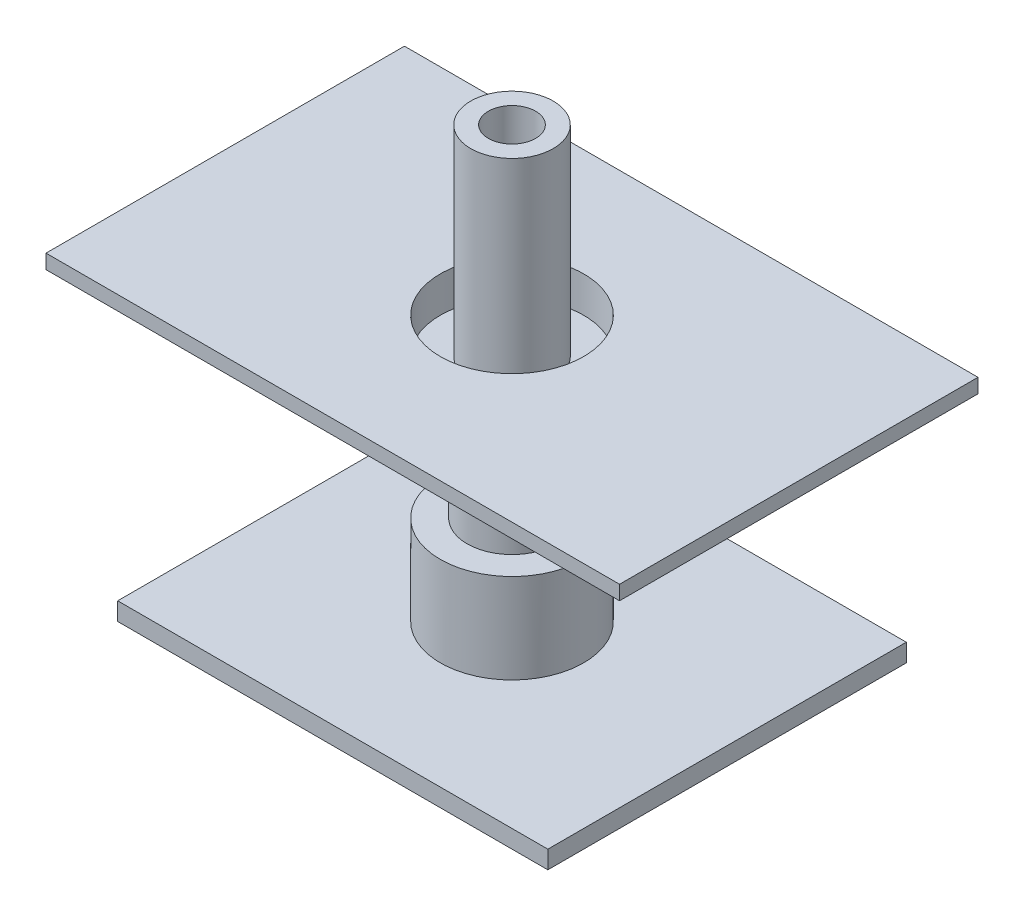
from build123d import *

# Parameters (mm, degrees)
SKETCH1_W           = 120
SKETCH1_H           = 100
BOSS_EXTRUDE1_DEPTH = 5
SKETCH2_R           = 20
SKETCH2_R_2         = 12.5
BOSS_EXTRUDE2_DEPTH = 25
SKETCH4_R           = 12.5
BOSS_EXTRUDE3_DEPTH = 60
SKETCH5_R           = 6.586855475
CUT_EXTRUDE1_DEPTH  = 30
SKETCH9_R           = 11.5
SKETCH9_R_2         = 6.586855475
BOSS_EXTRUDE6_DEPTH = 60
BOSS_EXTRUDE4_START = 10
SKETCH6_W           = 160
SKETCH6_H           = 100
SKETCH6_R           = 12.5
BOSS_EXTRUDE4_DEPTH = 4
SKETCH10_R          = 22.5
SKETCH10_R_2        = 11.5
BOSS_EXTRUDE7_DEPTH = 14
CUT_EXTRUDE5_START  = -10
SKETCH8_R           = 20
SKETCH8_R_2         = 11.5
CUT_EXTRUDE5_DEPTH  = 10


with BuildPart() as part:
    # Sketch1 → Boss-Extrude1 (new body)
    with BuildSketch(Plane(origin=(0, 0, 0), x_dir=(1, 0, 0), z_dir=(0, 1, 0))):
        Rectangle(SKETCH1_W, SKETCH1_H)
    extrude(amount=BOSS_EXTRUDE1_DEPTH)

    # Sketch2 → Boss-Extrude2 (add)
    with BuildSketch(Plane(origin=(0, 5, 0), x_dir=(1, 0, 0), z_dir=(0, 1, 0))):
        with Locations(Location((0, 0, 0), (0, 0, 90))):
            Circle(SKETCH2_R)
        with Locations(Location((0, 0, 0), (0, 0, 270))):
            Circle(SKETCH2_R_2, mode=Mode.SUBTRACT)
    extrude(amount=BOSS_EXTRUDE2_DEPTH)


with BuildPart() as body_2:
    # Sketch4 → Boss-Extrude3 (new body)
    with BuildSketch(Plane(origin=(0, 5, 0), x_dir=(1, 0, 0), z_dir=(0, 1, 0))):
        with Locations(Location((0, 0, 0), (0, 0, 270))):
            Circle(SKETCH4_R)
    extrude(amount=BOSS_EXTRUDE3_DEPTH)

    # Sketch5 → Cut-Extrude1 (cut)
    with BuildSketch(Plane(origin=(0, 65, 0), x_dir=(1, 0, 0), z_dir=(0, 1, 0))):
        with Locations(Location((0, 0, 0), (0, 0, 270))):
            Circle(SKETCH5_R)
    extrude(amount=-CUT_EXTRUDE1_DEPTH, mode=Mode.SUBTRACT)

    # Sketch9 → Boss-Extrude6 (add)
    with BuildSketch(Plane(origin=(0, 65, 0), x_dir=(1, 0, 0), z_dir=(0, 1, 0))):
        with Locations(Location((0, 0, 0), (0, 0, 270))):
            Circle(SKETCH9_R)
        with Locations(Location((0, 0, 0), (0, 0, 270))):
            Circle(SKETCH9_R_2, mode=Mode.SUBTRACT)
    extrude(amount=BOSS_EXTRUDE6_DEPTH)



with BuildPart() as body_3:
    # Sketch6 → Boss-Extrude4 (new body)
    with BuildSketch(Plane(origin=(0, 65, 0), x_dir=(1, 0, 0), z_dir=(0, 1, 0)).offset(BOSS_EXTRUDE4_START)):
        Rectangle(SKETCH6_W, SKETCH6_H)
        with Locations(Location((0, 0, 0), (0, 0, 270))):
            Circle(SKETCH6_R, mode=Mode.SUBTRACT)
    extrude(amount=BOSS_EXTRUDE4_DEPTH)


with BuildPart() as body_2_1:
    add(body_2.part)

    add(body_3.part)  # Boss-Extrude7 merges body 3
    # Sketch10 → Boss-Extrude7 (add)
    with BuildSketch(Plane(origin=(0, 79, 0), x_dir=(1, 0, 0), z_dir=(0, 1, 0))):
        with Locations(Location((0, 0, 0), (0, 0, 270))):
            Circle(SKETCH10_R)
        with Locations(Location((0, 0, 0), (0, 0, 270))):
            Circle(SKETCH10_R_2, mode=Mode.SUBTRACT)
    extrude(amount=-BOSS_EXTRUDE7_DEPTH)

    # Sketch8 → Cut-Extrude5 (cut)
    with BuildSketch(Plane(origin=(0, 79, 0), x_dir=(1, 0, 0), z_dir=(0, 1, 0)).offset(CUT_EXTRUDE5_START)):
        with Locations(Location((0, 0, 0), (0, 0, 270))):
            Circle(SKETCH8_R)
        with Locations(Location((0, 0, 0), (0, 0, 270))):
            Circle(SKETCH8_R_2, mode=Mode.SUBTRACT)
    extrude(amount=CUT_EXTRUDE5_DEPTH, mode=Mode.SUBTRACT)


solid = Compound([part.part, body_2_1.part])
